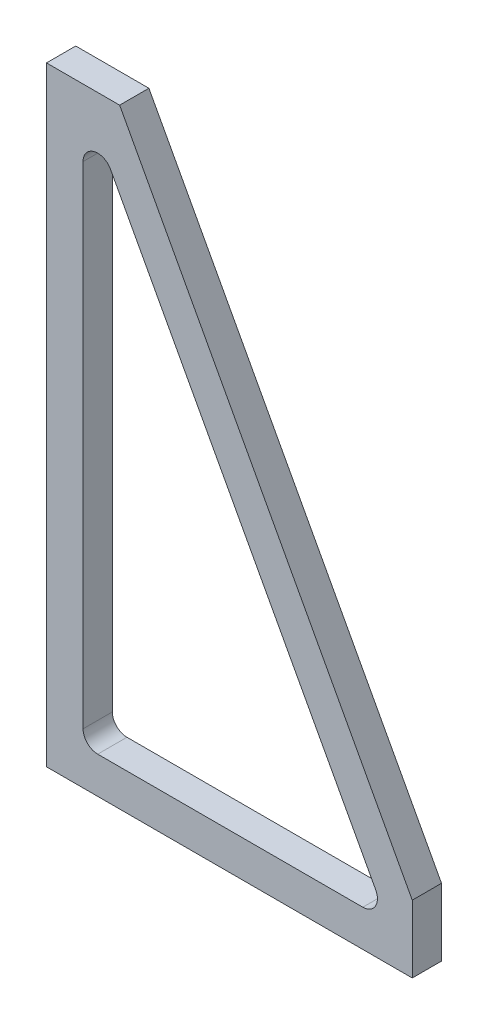
from build123d import *

# Parameters (mm, degrees)
BOSS_EXTRUDE2_DEPTH = 12


with BuildPart() as part:
    # Sketch1 → Boss-Extrude2 (new body)
    with BuildSketch(Plane.XY):
        Polygon((0, 250), (0, 0), (150, 0), (150, 27.638698422), (30, 250), align=None)
        with BuildLine():
            Line((21, 15), (129.719822185, 15))
            ThreePointArc((129.719822185, 15), (134.872349516, 17.925676968), (135, 23.849512632))
            Line((135, 23.849512632), (26.280177815, 225.308522369))
            ThreePointArc((26.280177815, 225.308522369), (19.530487647, 228.276271415), (15, 222.459009736))
            Line((15, 222.459009736), (15, 21))
            ThreePointArc((15, 21), (16.757359313, 16.757359313), (21, 15))
        make_face(mode=Mode.SUBTRACT)
    extrude(amount=BOSS_EXTRUDE2_DEPTH)


solid = part.part
